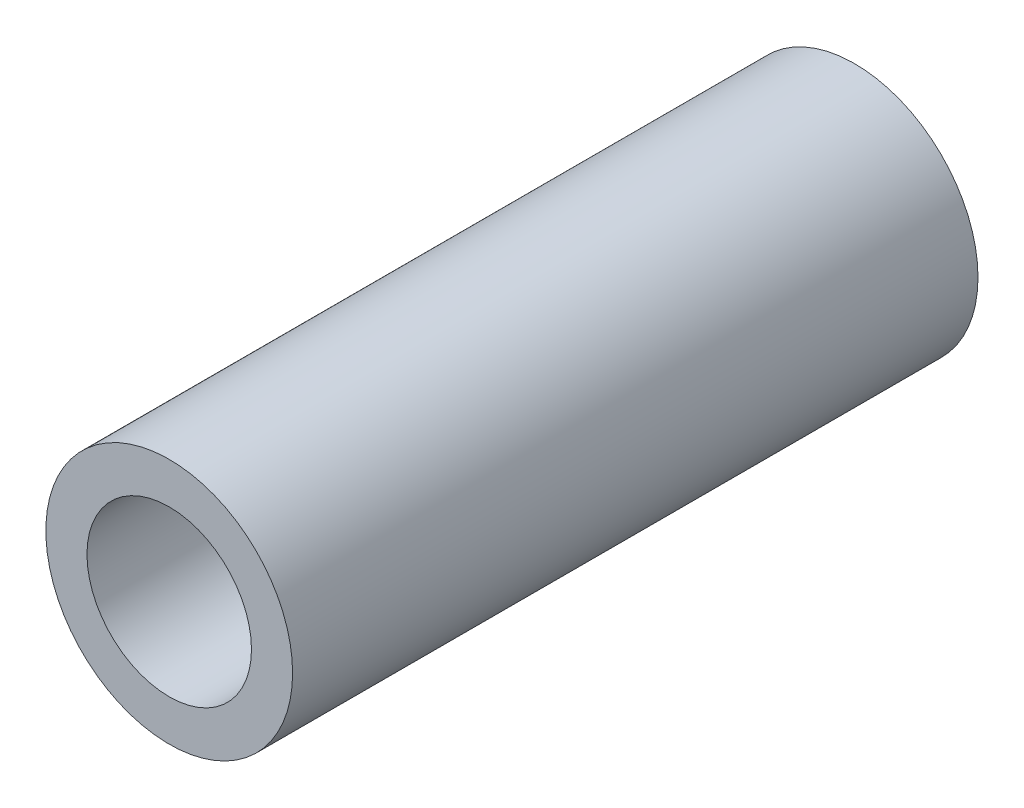
from build123d import *

# Parameters (mm, degrees)
SZKIC1_R                    = 9
SZKIC1_R_2                  = 6
DODANIE_WYCI_GNI_CIE1_DEPTH = 50


with BuildPart() as part:
    # Szkic1 → Dodanie-wyciągnięcie1 (new body)
    with BuildSketch(Plane.XY):
        Circle(SZKIC1_R)
        Circle(SZKIC1_R_2, mode=Mode.SUBTRACT)
    extrude(amount=DODANIE_WYCI_GNI_CIE1_DEPTH)


solid = part.part
